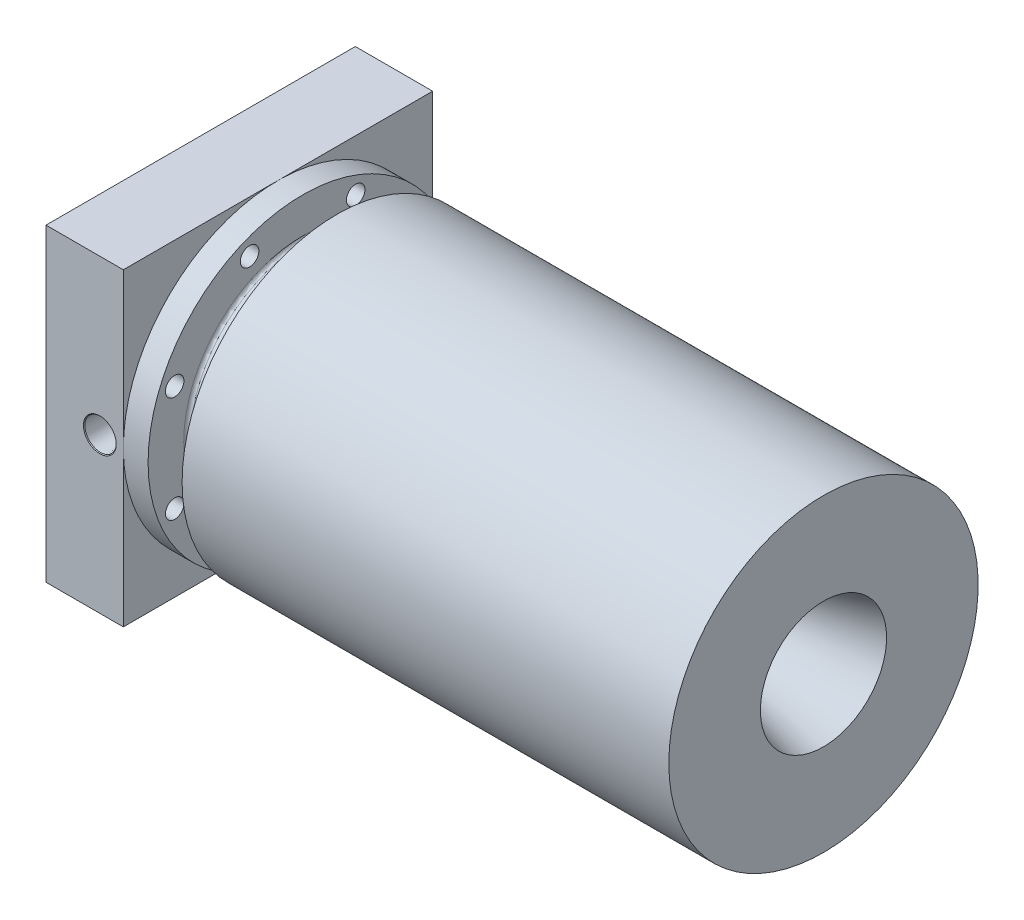
from build123d import *

# Parameters (mm, degrees)
FILLET1_R           = 1.27
CUT_EXTRUDE1_REACH  = 243.296
SKETCH2_R           = 3.81
CIRPATTERN1_COUNT   = 8
SKETCH4_R           = 63.5
BOSS_EXTRUDE1_DEPTH = 31.75
SKETCH2_2_R         = 3.81
CUT_EXTRUDE6_DEPTH  = 242.295706697
CIRPATTERN2_COUNT   = 8
BOSS_EXTRUDE2_START = -31.75
BOSS_EXTRUDE2_DEPTH = 31.75
SKETCH12_R          = 24.13
CUT_EXTRUDE4_DEPTH  = 15.24
CUT_EXTRUDE5_START  = -39.445315
SKETCH13_R          = 1.905
CUT_EXTRUDE5_DEPTH  = 39.445315
CHAMFER1_SIZE       = 4.572
FILLET2_R           = 0.889


with BuildPart() as part:
    # Chamber Revolve → Revolve1 (revolve)
    with BuildSketch(Plane.XY, mode=Mode.PRIVATE) as revolve1_sk:
        with BuildLine():
            Line((223.962313951, 63.5), (223.962313951, 25.908))
            Line((223.962313951, 25.908), (191.916500941, 17.321350283))
            ThreePointArc((191.916500941, 17.321350283), (190.601700192, 17.321350283), (189.463049342, 17.978750658))
            Line((189.463049342, 17.978750658), (173.5582, 33.8836))
            Line((173.5582, 33.8836), (0, 33.8836))
            Line((0, 33.8836), (0, 42.5196))
            Line((0, 42.5196), (3.8608, 42.5196))
            Line((3.8608, 42.5196), (3.8608, 48.5902))
            Line((3.8608, 48.5902), (0, 48.5902))
            Line((0, 48.5902), (0, 63.5))
            Line((0, 63.5), (10.16, 63.5))
            Line((10.16, 63.5), (10.16, 47.5996))
            Line((10.16, 47.5996), (24.13, 47.5996))
            Line((24.13, 47.5996), (24.13, 63.5))
            Line((24.13, 63.5), (223.962313951, 63.5))
        make_face()
    revolve(revolve1_sk.sketch.rotate(Axis((0, 0, 0), (1, 0, 0)), 90), axis=Axis((0, 0, 0), (1, 0, 0)))

    # Fillet1
    fillet1_edges = [part.edges().sort_by_distance(p)[0] for p in [
        (24.13, 0, -47.5996),
        (10.16, 0, -47.5996),
    ]]
    fillet(fillet1_edges, radius=FILLET1_R)

    # Sketch2 → Cut-Extrude1 (cut, up to next)
    with BuildSketch(Plane.ZY, mode=Mode.PRIVATE) as cut_extrude1_sk1:
        with Locations((-21.727276623, 52.584030528)):
            Circle(SKETCH2_R)
    cut_extrude1_tool1 = extrude(cut_extrude1_sk1.sketch, amount=-CUT_EXTRUDE1_REACH, mode=Mode.PRIVATE) & part.part
    cut_extrude1 = cut_extrude1_tool1.solids().sort_by_distance((0, 52.584031, -21.727277))[0]
    add(cut_extrude1, mode=Mode.SUBTRACT)

    # CirPattern1: Cut-Extrude1 ×8 about axis
    cirpattern1_axis = Axis((0, 0, 0), (1, 0, 0))
    for i in range(1, CIRPATTERN1_COUNT):
        add(cut_extrude1.rotate(cirpattern1_axis, i * 360 / CIRPATTERN1_COUNT), mode=Mode.SUBTRACT)

    # Fillet2
    fillet2_edges = [part.edges().sort_by_distance(p)[0] for p in [
        (3.8608, 0, -42.5196),
        (3.8608, 0, -48.5902),
    ]]
    fillet(fillet2_edges, radius=FILLET2_R)


with BuildPart() as body_2:
    # Sketch4 → Boss-Extrude1 (new body)
    with BuildSketch(Plane.ZY):
        Circle(SKETCH4_R)
    extrude(amount=BOSS_EXTRUDE1_DEPTH)

    # Sketch2<2> → Cut-Extrude6 (cut, through all)
    with BuildSketch(Plane.ZY):
        with Locations((-21.727276623, 52.584030528)):
            Circle(SKETCH2_2_R)
    cut_extrude6 = extrude(amount=CUT_EXTRUDE6_DEPTH, mode=Mode.SUBTRACT)

    # CirPattern2: Cut-Extrude6 ×8 about axis
    cirpattern2_axis = Axis((0, 0, 0), (1, 0, 0))
    for i in range(1, CIRPATTERN2_COUNT):
        add(cut_extrude6.rotate(cirpattern2_axis, i * 360 / CIRPATTERN2_COUNT), mode=Mode.SUBTRACT)

    # Sketch11 → Boss-Extrude2 (add)
    with BuildSketch(Plane.ZY.offset(31.75).offset(BOSS_EXTRUDE2_START)):
        with BuildLine():
            Line((-63.5, 7.8e-08), (-63.5, -63.5))
            Line((-63.5, -63.5), (-4.2e-08, -63.5))
            ThreePointArc((-4.2e-08, -63.5), (-44.901280648, -44.901280563), (-63.5, 7.8e-08))
        make_face()
        with BuildLine():
            ThreePointArc((63.5, 0), (44.901280591, -44.90128062), (-4.2e-08, -63.5))
            Line((-4.2e-08, -63.5), (63.5, -63.5))
            Line((63.5, -63.5), (63.5, 0))
        make_face()
        with BuildLine():
            Line((-63.5, 63.5), (-63.5, 7.8e-08))
            ThreePointArc((-63.5, 7.8e-08), (-44.901280564, 44.901280647), (3.9e-08, 63.5))
            Line((3.9e-08, 63.5), (-63.5, 63.5))
        make_face()
        with BuildLine():
            ThreePointArc((3.9e-08, 63.5), (44.901280619, 44.901280591), (63.5, 0))
            Line((63.5, 0), (63.5, 63.5))
            Line((63.5, 63.5), (3.9e-08, 63.5))
        make_face()
    extrude(amount=BOSS_EXTRUDE2_DEPTH)

    # Sketch12 → Cut-Extrude4 (cut)
    with BuildSketch(Plane(origin=(0, 0, 0), x_dir=(0, 0, -1), z_dir=(1, 0, 0))):
        Circle(SKETCH12_R)
    extrude(amount=-CUT_EXTRUDE4_DEPTH, mode=Mode.SUBTRACT)

    # Sketch13 → Cut-Extrude5 (cut)
    with BuildSketch(Plane.XY.offset(63.5).offset(CUT_EXTRUDE5_START)):
        with Locations((-9.652, 0)):
            Circle(SKETCH13_R)
    cut_extrude5 = extrude(amount=CUT_EXTRUDE5_DEPTH, mode=Mode.SUBTRACT)

    # Sketch17 → 1/4 NPT Tapped Hole2 (revolve, cut)
    with BuildSketch(Plane(origin=(-31.75, 0, 0), x_dir=(0, 0, 1), z_dir=(0, 1, 0))):
        Polygon((0, 0), (0, 16.511), (5.5626, 16.511), (5.5626, 19.05), (5.950171605, 19.05), (6.5140586, 0.2169414), (6.731, 0), align=None)
    revolve(axis=Axis((-38.1, 0, 0), (1, 0, 0)), mode=Mode.SUBTRACT)

    # Chamfer1
    chamfer1_edges = [body_2.edges().sort_by_distance(p)[0] for p in [
        (0, 0, 24.13),
    ]]
    chamfer(chamfer1_edges, length=CHAMFER1_SIZE)

    # Sketch20 → 1/4 NPT Tapped Hole1 (revolve, cut)
    with BuildSketch(Plane(origin=(-9.652, 0, 63.5), x_dir=(0, -1, 0), z_dir=(1, 0, 0))):
        Polygon((0, 0), (0, 26.964347279), (5.5626, 23.622), (5.5626, 16.51), (5.952451973, 16.51), (6.438011, 0.292989), (6.731, 0), align=None)
    f_1_4_npt_tapped_hole1 = revolve(axis=Axis((-9.652, 0, 69.85), (0, 0, -1)), mode=Mode.SUBTRACT)

    # Mirror1: Cut-Extrude5, 1/4 NPT Tapped Hole1 across plane
    add(cut_extrude5.mirror(Plane.XY), mode=Mode.SUBTRACT)
    add(f_1_4_npt_tapped_hole1.mirror(Plane.XY), mode=Mode.SUBTRACT)

    # Sketch23 → 1/4-28 Tapped Hole1 (revolve, cut)
    with BuildSketch(Plane(origin=(-31.75, -33.02, 0), x_dir=(0, 0, 1), z_dir=(0, 1, 0))):
        Polygon((0, 0), (0, 18.389388061), (2.7051, 16.764), (2.7051, 1.1049), (3.81, 0), align=None)
    f_1_4_28_tapped_hole1 = revolve(axis=Axis((-38.1, -33.02, 0), (1, 0, 0)), mode=Mode.SUBTRACT)

    # Mirror2: 1/4-28 Tapped Hole1 across plane
    add(f_1_4_28_tapped_hole1.mirror(Plane.ZX), mode=Mode.SUBTRACT)


with BuildPart() as body_3:
    # Sketch21 → Revolve2 (revolve)
    with BuildSketch(Plane(origin=(0, 0, 0), x_dir=(1, 0, 0), z_dir=(0, 1, 0))):
        Polygon((0, 33.8836), (173.5582, 33.8836), (189.463049342, 17.978750658), (189.463049342, 0), (0, 0), align=None)
    revolve(axis=Axis((189.463049342, 0, 0), (1, 0, 0)))


solid = Compound([part.part, body_2.part, body_3.part])
